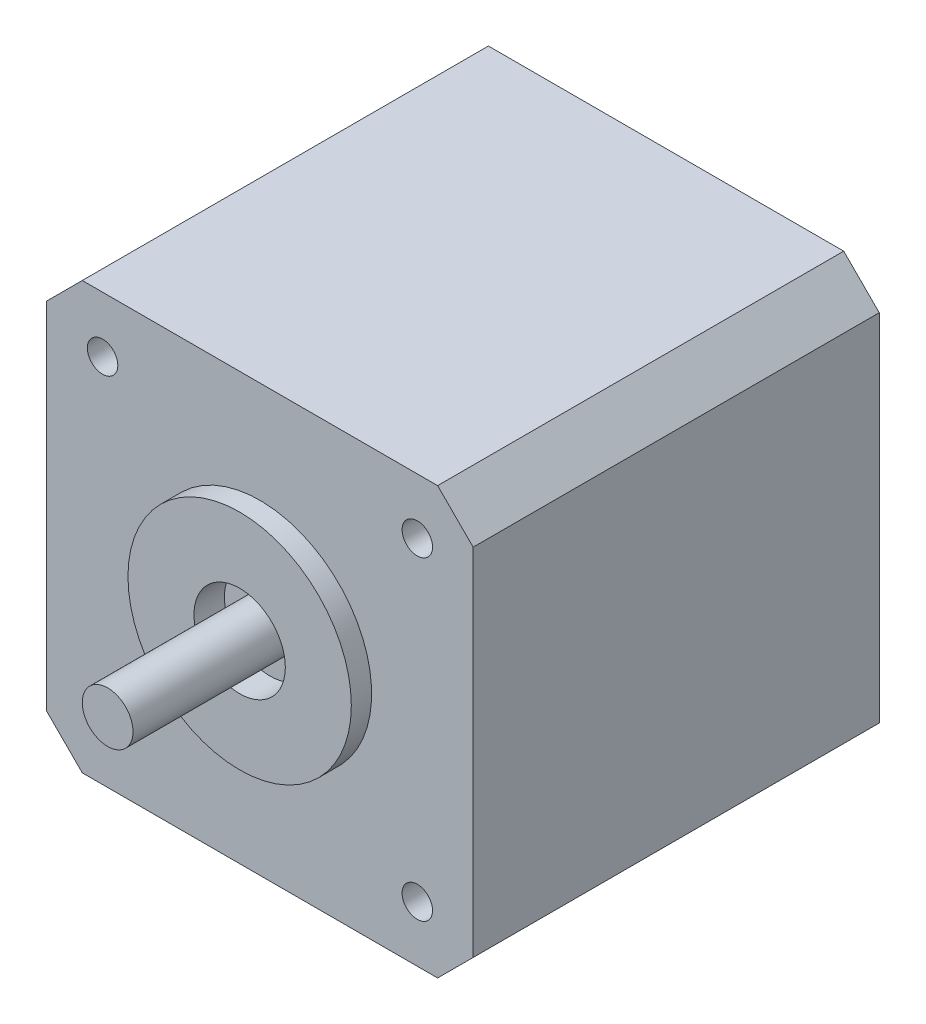
from build123d import *

# Parameters (mm, degrees)
SKETCH1_W           = 42
SKETCH1_H           = 42
BOSS_EXTRUDE1_DEPTH = 40
CHAMFER1_SIZE       = 3.5
SKETCH2_R           = 11
BOSS_EXTRUDE2_DEPTH = 2
SKETCH3_R           = 1.5
CUT_EXTRUDE1_DEPTH  = 50.819674828
SKETCH4_R           = 2.5
BOSS_EXTRUDE3_DEPTH = 13
BOSS_EXTRUDE4_START = 15
SKETCH5_R           = 2.5
BOSS_EXTRUDE4_DEPTH = 15
CUT_EXTRUDE2_START  = -3
SKETCH8_R           = 4.5
SKETCH8_R_2         = 2.5
CUT_EXTRUDE2_DEPTH  = 3


with BuildPart() as part:
    # Sketch1 → Boss-Extrude1 (new body)
    with BuildSketch(Plane.XY):
        Rectangle(SKETCH1_W, SKETCH1_H)
    extrude(amount=-BOSS_EXTRUDE1_DEPTH)

    # Chamfer1
    chamfer1_edges = [part.edges().sort_by_distance(p)[0] for p in [
        (21, -21, -20),
        (-21, -21, -20),
        (-21, 21, -20),
        (21, 21, -20),
    ]]
    chamfer(chamfer1_edges, length=CHAMFER1_SIZE)

    # Sketch2 → Boss-Extrude2 (add)
    with BuildSketch(Plane.XY):
        with Locations(Location((0, 0, 0), (0, 0, 180))):
            Circle(SKETCH2_R)
    extrude(amount=BOSS_EXTRUDE2_DEPTH)

    # Sketch3 → Cut-Extrude1 (cut, through all)
    with BuildSketch(Plane.XY):
        with Locations((15.5, 15.5)):
            Circle(SKETCH3_R)
        with Locations((-15.5, 15.5)):
            Circle(SKETCH3_R)
        with Locations((-15.5, -15.5)):
            Circle(SKETCH3_R)
        with Locations((15.5, -15.5)):
            Circle(SKETCH3_R)
    extrude(amount=-CUT_EXTRUDE1_DEPTH, mode=Mode.SUBTRACT)

    # Sketch4 → Boss-Extrude3 (add)
    with BuildSketch(Plane.XY.offset(2)):
        with Locations(Location((0, 0, 0), (0, 0, 180))):
            Circle(SKETCH4_R)
    extrude(amount=BOSS_EXTRUDE3_DEPTH)

    # Sketch5 → Boss-Extrude4 (add)
    with BuildSketch(Plane(origin=(0, 0, -40), x_dir=(-1, 0, 0), z_dir=(0, 0, -1)).offset(BOSS_EXTRUDE4_START)):
        Circle(SKETCH5_R)
    extrude(amount=-BOSS_EXTRUDE4_DEPTH)

    # Sketch8 → Cut-Extrude2 (cut)
    with BuildSketch(Plane.XY.offset(2).offset(CUT_EXTRUDE2_START)):
        Circle(SKETCH8_R)
        with Locations(Location((0, 0, 0), (0, 0, 180))):
            Circle(SKETCH8_R_2, mode=Mode.SUBTRACT)
    extrude(amount=CUT_EXTRUDE2_DEPTH, mode=Mode.SUBTRACT)


solid = part.part
